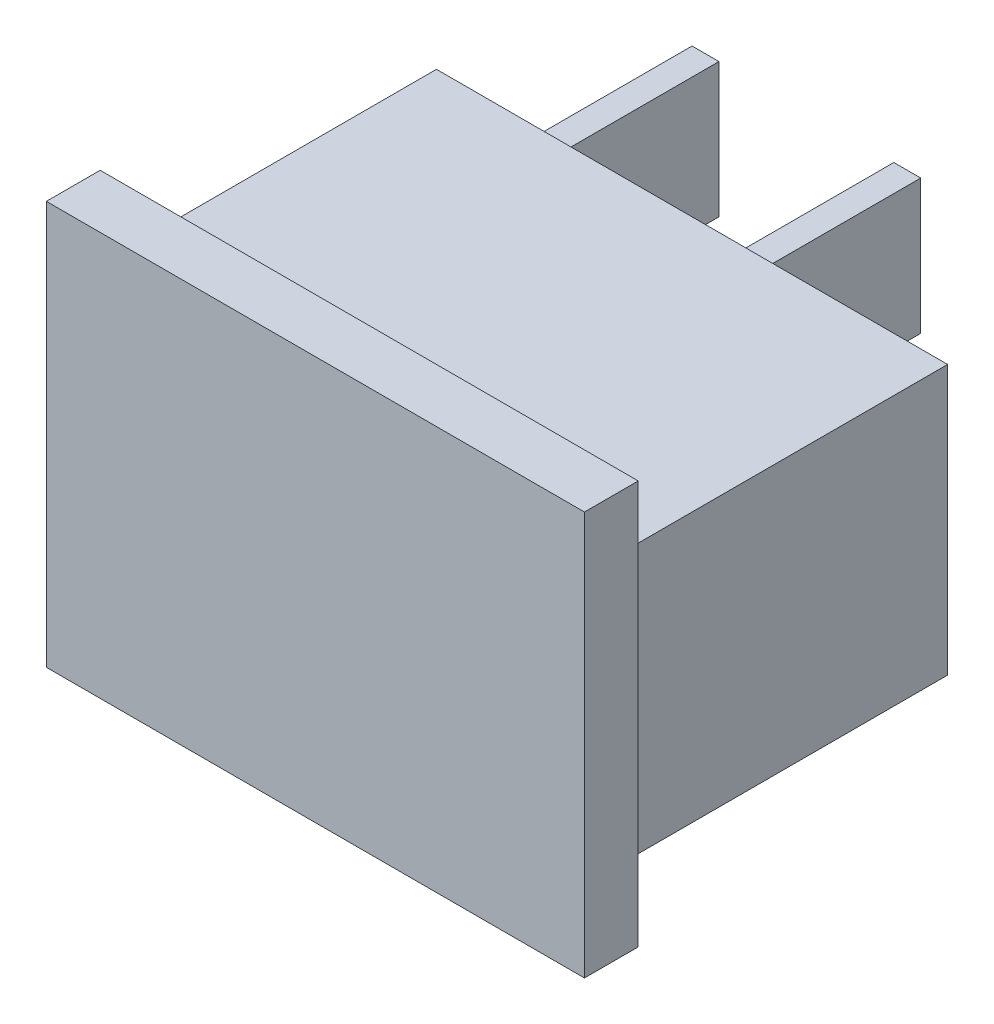
from build123d import *

# Parameters (mm, degrees)
ESQUISSE1_W        = 19
ESQUISSE1_H        = 12
BOSS_EXTRU_1_DEPTH = 10
ESQUISSE2_W        = 20
ESQUISSE2_H        = 15
BOSS_EXTRU_2_DEPTH = 2
ESQUISSE3_W        = 1
ESQUISSE3_H        = 5
BOSS_EXTRU_3_DEPTH = 8


with BuildPart() as part:
    # Esquisse1 → Boss.-Extru.1 (new body)
    with BuildSketch(Plane(origin=(0, 0, 0), x_dir=(1, 0, 0), z_dir=(0, 1, 0))):
        with Locations((9.5, 6)):
            Rectangle(ESQUISSE1_W, ESQUISSE1_H)
    extrude(amount=BOSS_EXTRU_1_DEPTH)

    # Esquisse2 → Boss.-Extru.2 (add)
    with BuildSketch(Plane.XY):
        with Locations((9.5, 5)):
            Rectangle(ESQUISSE2_W, ESQUISSE2_H)
    extrude(amount=BOSS_EXTRU_2_DEPTH)

    # Esquisse3 → Boss.-Extru.3 (add)
    with BuildSketch(Plane(origin=(0, 0, -12), x_dir=(-1, 0, 0), z_dir=(0, 0, -1))):
        with Locations((-9.5, 5)):
            Rectangle(ESQUISSE3_W, ESQUISSE3_H)
        with Locations((-2, 5)):
            Rectangle(ESQUISSE3_W, ESQUISSE3_H)
    extrude(amount=BOSS_EXTRU_3_DEPTH)


solid = part.part
